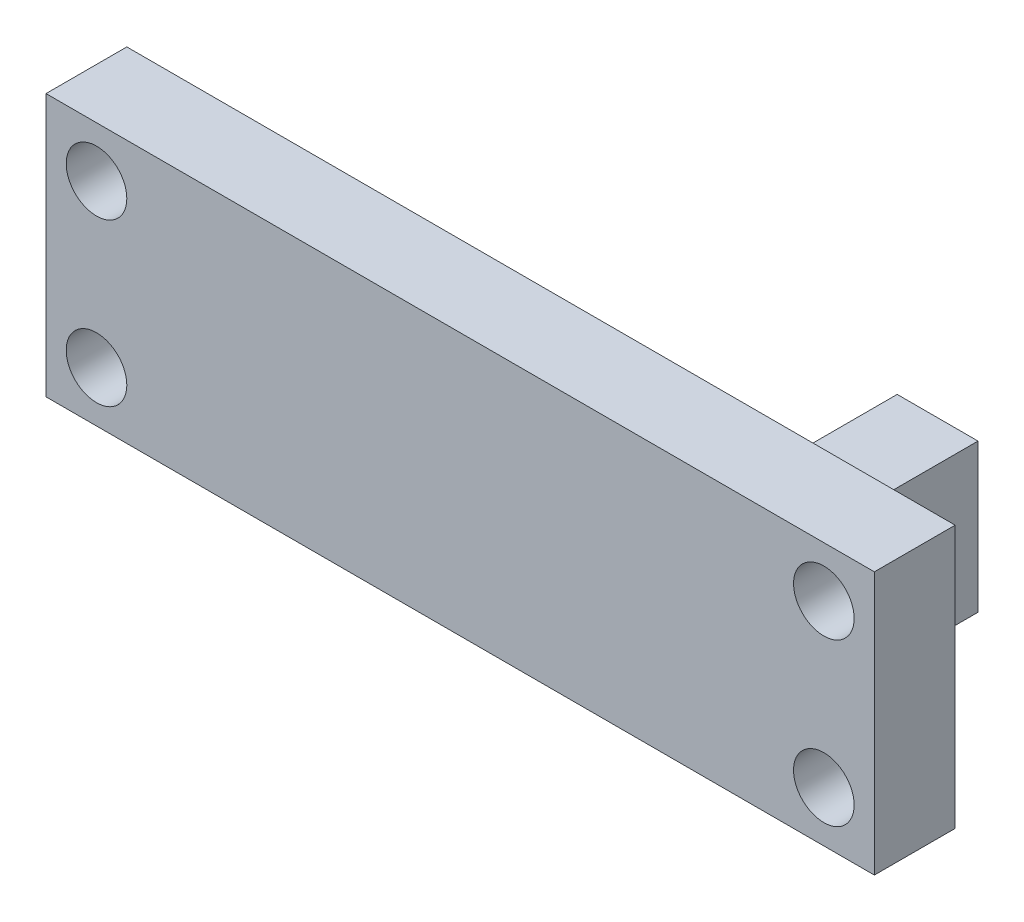
from build123d import *

# Parameters (mm, degrees)
CROQUIS1_W              = 41
CROQUIS1_H              = 13
SALIENTE_EXTRUIR1_DEPTH = 4
CROQUIS2_R              = 1.5
CORTAR_EXTRUIR1_DEPTH   = 44.197222133
CROQUIS3_W              = 4
CROQUIS3_H              = 7.34
SALIENTE_EXTRUIR2_DEPTH = 7


with BuildPart() as part:
    # Croquis1 → Saliente-Extruir1 (new body)
    with BuildSketch(Plane.XY):
        with Locations((-20.5, 6.5)):
            Rectangle(CROQUIS1_W, CROQUIS1_H)
    extrude(amount=SALIENTE_EXTRUIR1_DEPTH)

    # Croquis2 → Cortar-Extruir1 (cut, through all)
    with BuildSketch(Plane.XY.offset(4)):
        with Locations((-2.5, 10.5)):
            Circle(CROQUIS2_R)
        with Locations((-2.5, 2.5)):
            Circle(CROQUIS2_R)
        with Locations((-38.5, 10.5)):
            Circle(CROQUIS2_R)
        with Locations((-38.5, 2.5)):
            Circle(CROQUIS2_R)
    extrude(amount=-CORTAR_EXTRUIR1_DEPTH, mode=Mode.SUBTRACT)

    # Croquis3 → Saliente-Extruir2 (add)
    with BuildSketch(Plane(origin=(0, 0, 0), x_dir=(-1, 0, 0), z_dir=(0, 0, -1))):
        with Locations((7.87, 6.5)):
            Rectangle(CROQUIS3_W, CROQUIS3_H)
    extrude(amount=SALIENTE_EXTRUIR2_DEPTH)


solid = part.part
